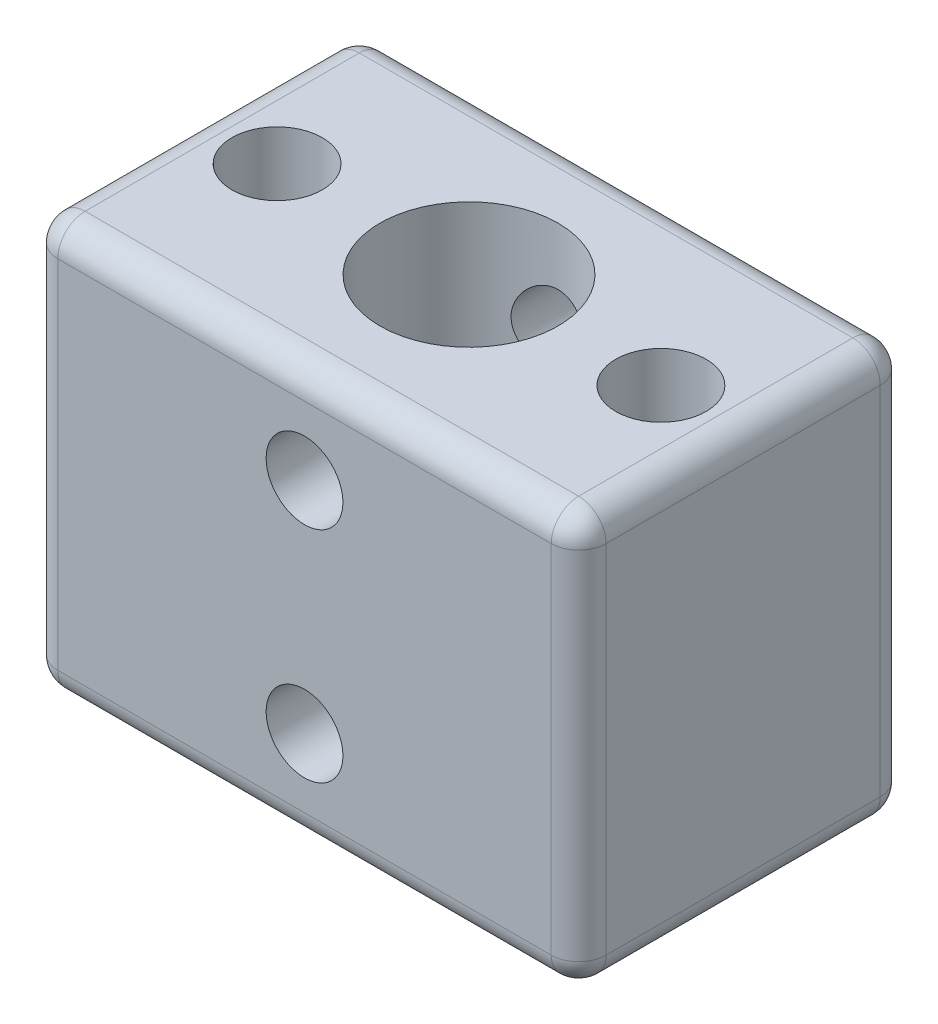
from build123d import *

# Parameters (mm, degrees)
SKETCH_1_W          = 20
SKETCH_1_H          = 12
SKETCH_1_R          = 3.25
SKETCH_1_R_2        = 1.65
EXTRUDE_1_DEPTH     = 7.5
SKETCH_3_R          = 1.4
CUT_EXTRUDE_1_DEPTH = 15
FILLET_1_R          = 1


with BuildPart() as part:
    # 草图1 → 凸台-拉伸1 (new, symmetric)
    with BuildSketch(Plane(origin=(0, 0, 0), x_dir=(1, 0, 0), z_dir=(0, 1, 0))):
        Rectangle(SKETCH_1_W, SKETCH_1_H)
        with Locations(Location((0, 0, 0), (0, 0, 270))):
            Circle(SKETCH_1_R, mode=Mode.SUBTRACT)
        with Locations(Location((-7, 0, 0), (0, 0, 270))):
            Circle(SKETCH_1_R_2, mode=Mode.SUBTRACT)
        with Locations(Location((7, 0, 0), (0, 0, 270))):
            Circle(SKETCH_1_R_2, mode=Mode.SUBTRACT)
    extrude(amount=EXTRUDE_1_DEPTH, both=True)

    # 草图3 → 切除-拉伸1 (cut)
    with BuildSketch(Plane(origin=(0, 0, -6), x_dir=(-1, 0, 0), z_dir=(0, 0, -1))):
        with Locations((0, 4)):
            Circle(SKETCH_3_R)
        with Locations((0, -4)):
            Circle(SKETCH_3_R)
    extrude(amount=-CUT_EXTRUDE_1_DEPTH, mode=Mode.SUBTRACT)

    # 圆角1
    fillet_1_edges = [part.edges().sort_by_distance(p)[0] for p in [
        (-10, 7.5, 0),
        (0, 7.5, 6),
        (10, 7.5, 0),
        (0, -7.5, 6),
        (-10, -7.5, 0),
        (0, -7.5, -6),
        (10, -7.5, 0),
        (10, 0, 6),
        (-10, 0, 6),
        (-10, 0, -6),
        (10, 0, -6),
        (0, 7.5, -6),
    ]]
    fillet(fillet_1_edges, radius=FILLET_1_R)


solid = part.part
